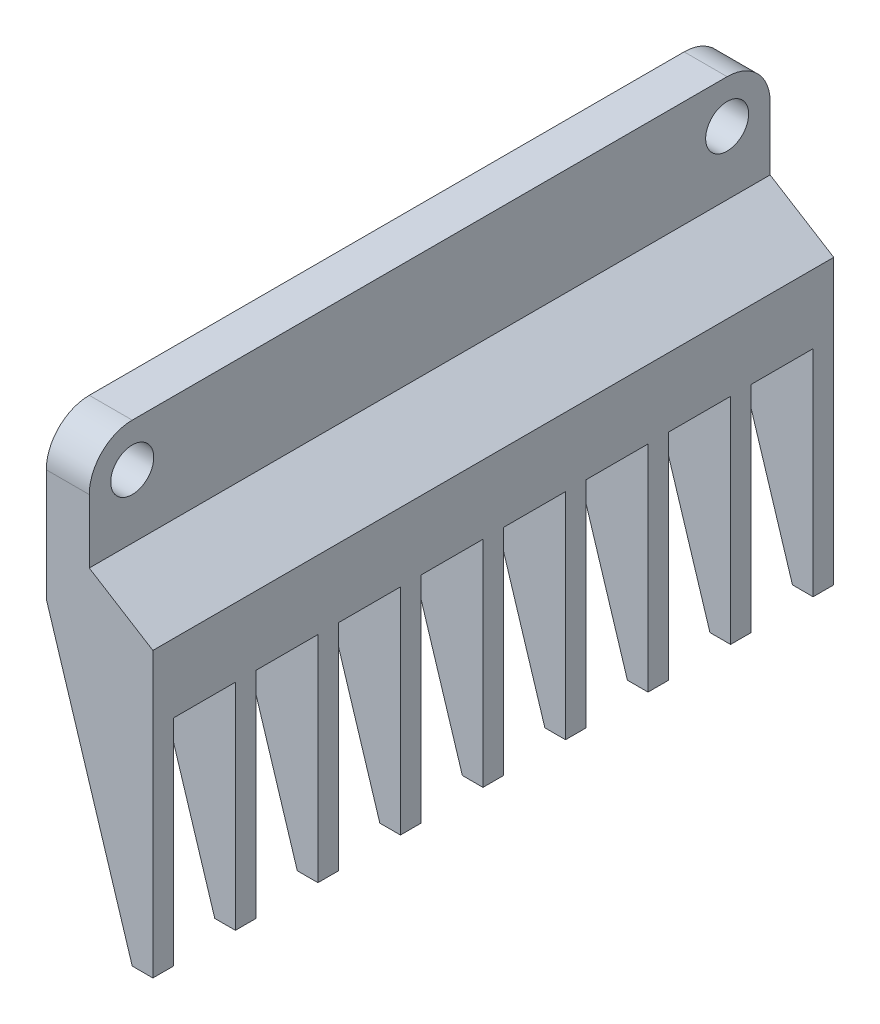
from build123d import *

# Parameters (mm, degrees)
BOSS_EXTRUDE1_DEPTH = 100.584
FILLET1_R           = 6.35
SKETCH6_R           = 3.175
CUT_EXTRUDE2_DEPTH  = 62.992
SKETCH7_W           = 9.144
SKETCH7_H           = 31.75
CUT_EXTRUDE5_DEPTH  = 120.989126841


with BuildPart() as part:
    # Sketch1 → Boss-Extrude1 (new body)
    with BuildSketch(Plane.XY):
        Polygon((0, 0), (3.048, 0), (3.048, 41.91), (-6.35, 47.752), (-6.35, 63.5), (-12.7, 63.5), (-12.7, 40.64), align=None)
    extrude(amount=BOSS_EXTRUDE1_DEPTH)

    # Fillet1
    fillet1_edges = [part.edges().sort_by_distance(p)[0] for p in [
        (-9.525, 63.5, 100.584),
        (-9.525, 63.5, 0),
    ]]
    fillet(fillet1_edges, radius=FILLET1_R)

    # Sketch6 → Cut-Extrude2 (cut, symmetric)
    with BuildSketch(Plane(origin=(-6.35, 0, 0), x_dir=(0, 0, -1), z_dir=(1, 0, 0))):
        with Locations(Location((-94.234, 57.15, 0), (0, 0, 90))):
            Circle(SKETCH6_R)
        with Locations(Location((-6.35, 57.15, 0), (0, 0, 90))):
            Circle(SKETCH6_R)
    extrude(amount=CUT_EXTRUDE2_DEPTH, both=True, mode=Mode.SUBTRACT)

    # Sketch7 → Cut-Extrude5 (cut, through all)
    with BuildSketch(Plane(origin=(3.048, 0, 0), x_dir=(0, 0, -1), z_dir=(1, 0, 0))):
        with Locations((-92.964, 15.875)):
            Rectangle(SKETCH7_W, SKETCH7_H)
        with Locations((-80.772, 15.875)):
            Rectangle(SKETCH7_W, SKETCH7_H)
        with Locations((-68.58, 15.875)):
            Rectangle(SKETCH7_W, SKETCH7_H)
        with Locations((-56.388, 15.875)):
            Rectangle(SKETCH7_W, SKETCH7_H)
        with Locations((-44.196, 15.875)):
            Rectangle(SKETCH7_W, SKETCH7_H)
        with Locations((-32.004, 15.875)):
            Rectangle(SKETCH7_W, SKETCH7_H)
        with Locations((-19.812, 15.875)):
            Rectangle(SKETCH7_W, SKETCH7_H)
        with Locations((-7.62, 15.875)):
            Rectangle(SKETCH7_W, SKETCH7_H)
    extrude(amount=-CUT_EXTRUDE5_DEPTH, mode=Mode.SUBTRACT)


solid = part.part
